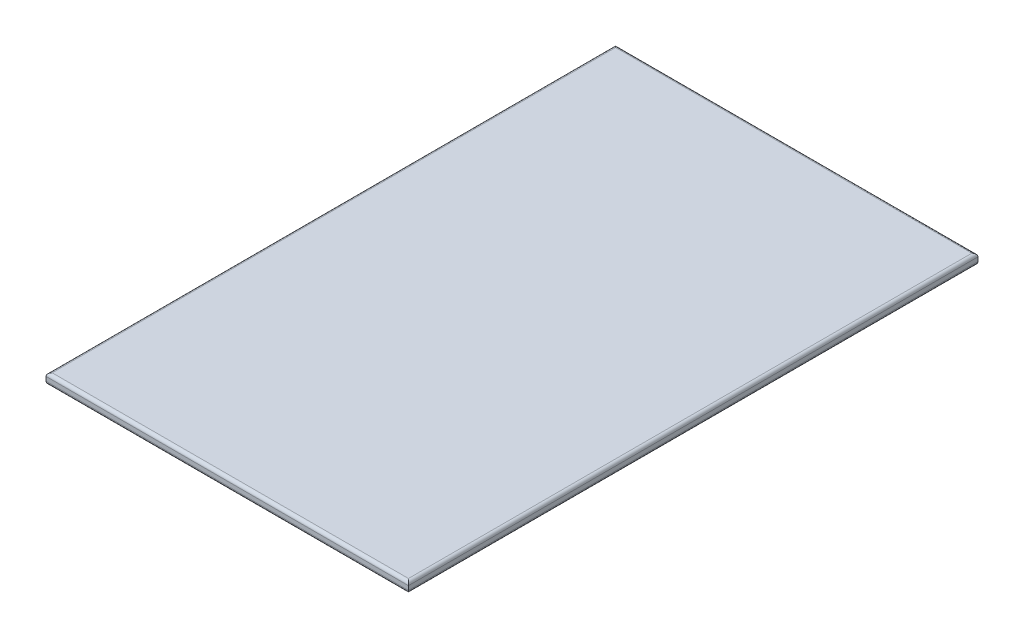
from build123d import *

# Parameters (mm, degrees)
SKETCH1_W           = 35
SKETCH1_H           = 55
BOSS_EXTRUDE1_DEPTH = 1
FILLET3_R           = 0.3


with BuildPart() as part:
    # Sketch1 → Boss-Extrude1 (new body)
    with BuildSketch(Plane(origin=(0, 0, 0), x_dir=(1, 0, 0), z_dir=(0, 1, 0))):
        Rectangle(SKETCH1_W, SKETCH1_H)
    extrude(amount=BOSS_EXTRUDE1_DEPTH)

    # Fillet3
    fillet3_edges = [part.edges().sort_by_distance(p)[0] for p in [
        (-17.5, 1, 0),
        (0, 1, 27.5),
        (17.5, 1, 0),
        (0, 0, 27.5),
        (-17.5, 0, 0),
        (0, 0, -27.5),
        (17.5, 0, 0),
        (0, 1, -27.5),
    ]]
    fillet(fillet3_edges, radius=FILLET3_R)


solid = part.part
